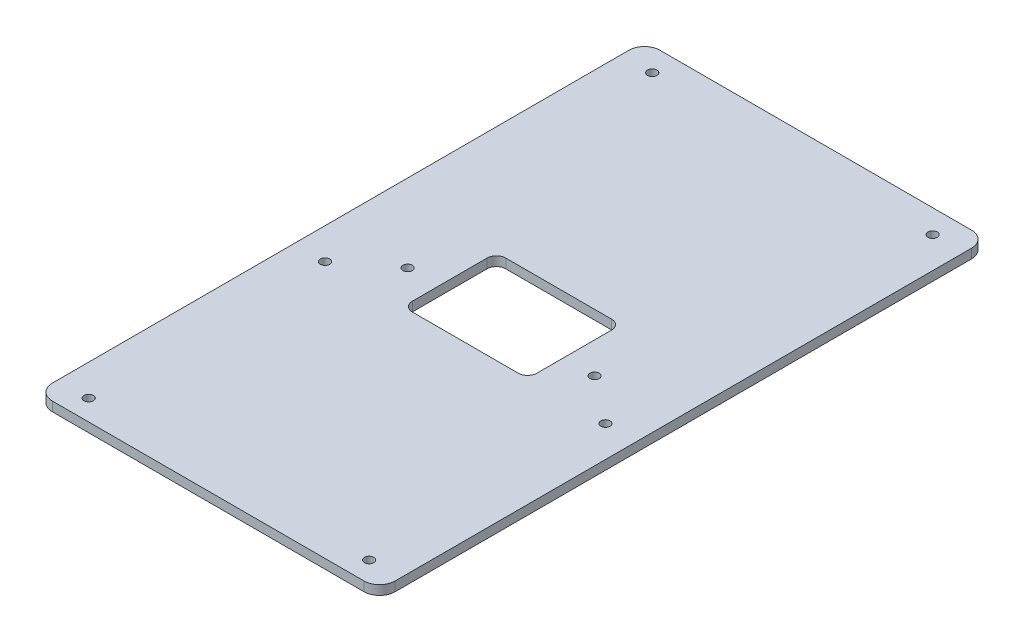
from build123d import *

# Parameters (mm, degrees)
CROQUIS1_W              = 110
CROQUIS1_H              = 195
SALIENTE_EXTRUIR1_DEPTH = 3
REDONDEO1_R             = 5
CROQUIS2_R              = 1.5
CORTAR_EXTRUIR1_DEPTH   = 3
CROQUIS3_W              = 40
CROQUIS3_H              = 30
CORTAR_EXTRUIR2_DEPTH   = 3
REDONDEO2_R             = 3


with BuildPart() as part:
    # Croquis1 → Saliente-Extruir1 (new body)
    with BuildSketch(Plane(origin=(0, 0, 0), x_dir=(1, 0, 0), z_dir=(0, 1, 0))):
        Rectangle(CROQUIS1_W, CROQUIS1_H)
    extrude(amount=SALIENTE_EXTRUIR1_DEPTH)

    # Redondeo1
    redondeo1_edges = [part.edges().sort_by_distance(p)[0] for p in [
        (55, 1.5, 97.5),
        (-55, 1.5, 97.5),
        (-55, 1.5, -97.5),
        (55, 1.5, -97.5),
    ]]
    fillet(redondeo1_edges, radius=REDONDEO1_R)

    # Croquis2 → Cortar-Extruir1 (cut)
    with BuildSketch(Plane(origin=(0, 3, 0), x_dir=(1, 0, 0), z_dir=(0, 1, 0))):
        with Locations(Location((-45, -90.857864376, 0), (0, 0, 270))):
            Circle(CROQUIS2_R)
        with Locations(Location((-45, -15, 0), (0, 0, 270))):
            Circle(CROQUIS2_R)
        with Locations(Location((-45, 90, 0), (0, 0, 270))):
            Circle(CROQUIS2_R)
        with Locations(Location((45, 90, 0), (0, 0, 270))):
            Circle(CROQUIS2_R)
        with Locations(Location((45, -15, 0), (0, 0, 270))):
            Circle(CROQUIS2_R)
        with Locations(Location((45, -90.857864376, 0), (0, 0, 270))):
            Circle(CROQUIS2_R)
        with Locations(Location((-30, -3.5, 0), (0, 0, 270))):
            Circle(CROQUIS2_R)
        with Locations(Location((30, -3.5, 0), (0, 0, 270))):
            Circle(CROQUIS2_R)
    extrude(amount=-CORTAR_EXTRUIR1_DEPTH, mode=Mode.SUBTRACT)

    # Croquis3 → Cortar-Extruir2 (cut)
    with BuildSketch(Plane(origin=(0, 3, 0), x_dir=(1, 0, 0), z_dir=(0, 1, 0))):
        Rectangle(CROQUIS3_W, CROQUIS3_H)
    extrude(amount=-CORTAR_EXTRUIR2_DEPTH, mode=Mode.SUBTRACT)

    # Redondeo2
    redondeo2_edges = [part.edges().sort_by_distance(p)[0] for p in [
        (20, 1.5, -15),
        (20, 1.5, 15),
        (-20, 1.5, 15),
        (-20, 1.5, -15),
    ]]
    fillet(redondeo2_edges, radius=REDONDEO2_R)


solid = part.part
